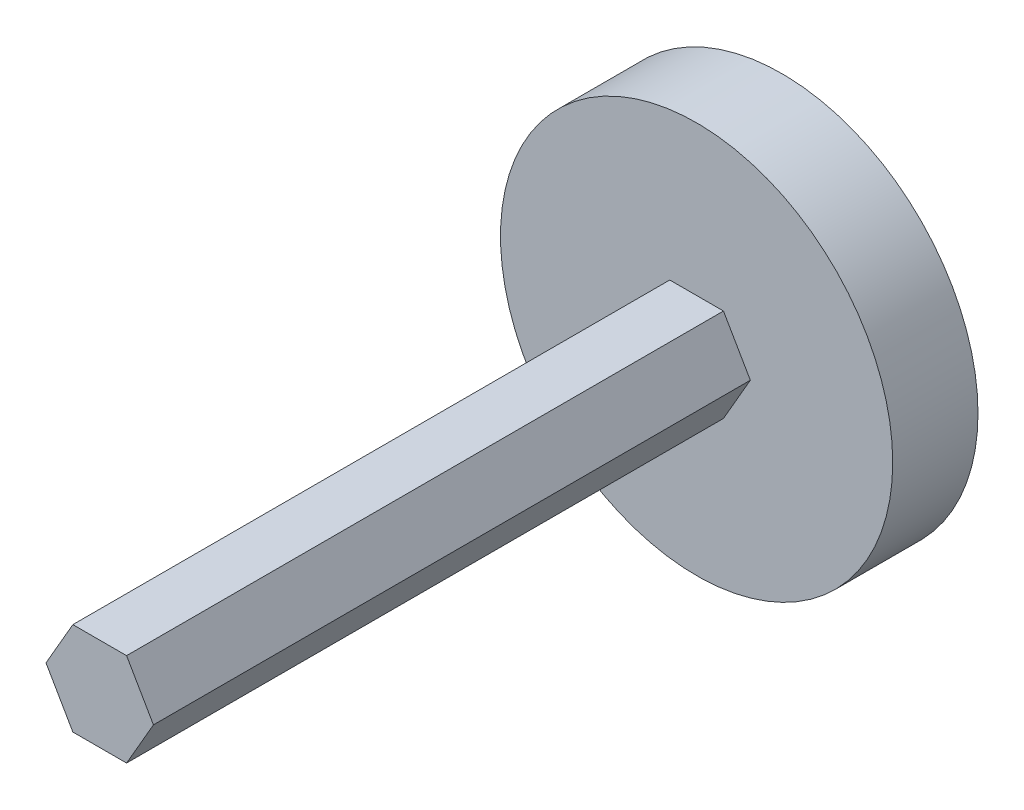
from build123d import *

# Parameters (mm, degrees)
SKETCH2_R           = 23
BOSS_EXTRUDE1_DEPTH = 10
BOSS_EXTRUDE2_DEPTH = 80
SKETCH5_R           = 0.5
BOSS_EXTRUDE3_DEPTH = 5


with BuildPart() as part:
    # Sketch2 → Boss-Extrude1 (new body)
    with BuildSketch(Plane.XY):
        Circle(SKETCH2_R)
        Polygon((-6.3, 0), (-3.15, -5.455960044), (3.15, -5.455960044), (6.3, 0), (3.15, 5.455960044), (-3.15, 5.455960044), align=None, mode=Mode.SUBTRACT)
    extrude(amount=BOSS_EXTRUDE1_DEPTH)

    # Sketch2<2> → Boss-Extrude2 (add)
    with BuildSketch(Plane.XY):
        Polygon((-3.15, 5.455960044), (-6.3, 0), (-3.15, -5.455960044), (3.15, -5.455960044), (6.3, 0), (3.15, 5.455960044), align=None)
    extrude(amount=BOSS_EXTRUDE2_DEPTH)

    # Sketch5 → Boss-Extrude3 (add)
    with BuildSketch(Plane(origin=(0, 0, 0), x_dir=(-1, 0, 0), z_dir=(0, 0, -1))):
        with Locations((0, 10)):
            Circle(SKETCH5_R)
        with Locations((-7.068259509, 7.073875)):
            Circle(SKETCH5_R)
        with Locations((7.068259509, 7.073875)):
            Circle(SKETCH5_R)
        with Locations((-9.999996847, 0.007941503)):
            Circle(SKETCH5_R)
        with Locations((-7.07948603, -7.06263956)):
            Circle(SKETCH5_R)
        with Locations((-0.015888246, -10)):
            Circle(SKETCH5_R)
        with Locations((7.057007753, -7.08509997)):
            Circle(SKETCH5_R)
        with Locations((9.961481677, -0.007916121)):
            Circle(SKETCH5_R)
    extrude(amount=BOSS_EXTRUDE3_DEPTH)


solid = part.part
